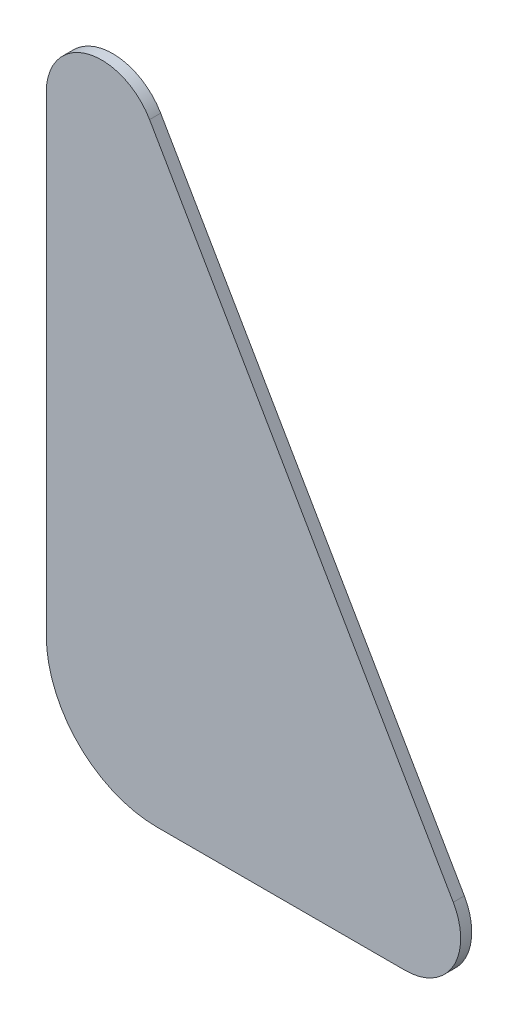
from build123d import *

# Parameters (mm, degrees)
BOSS_EXTRUDE1_DEPTH = 10


with BuildPart() as part:
    # Sketch1 → Boss-Extrude1 (new body)
    with BuildSketch(Plane.XY):
        with BuildLine():
            Line((0, 100), (0, 525))
            ThreePointArc((0, 525), (37.059047745, 573.296291314), (93.301270189, 550))
            Line((93.301270189, 550), (367.542648054, 75))
            ThreePointArc((367.542648054, 75), (367.542648054, 25), (324.241377865, 0))
            Line((324.241377865, 0), (100, 0))
            ThreePointArc((100, 0), (29.289321881, 29.289321881), (0, 100))
        make_face()
    extrude(amount=BOSS_EXTRUDE1_DEPTH)


solid = part.part
